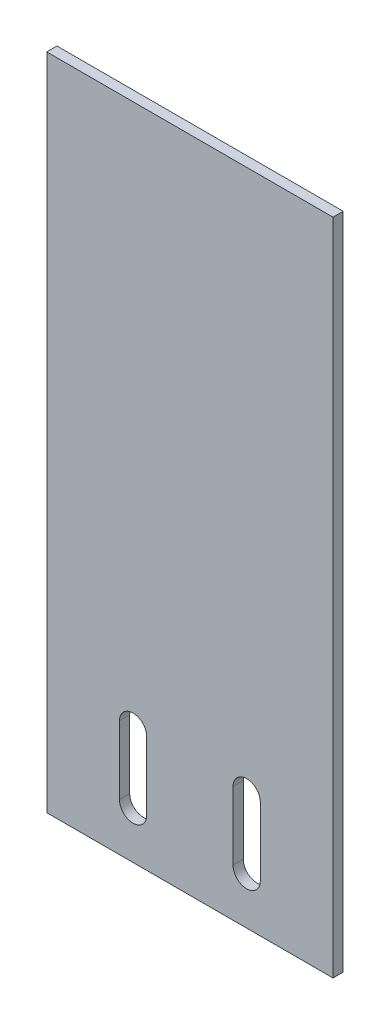
from build123d import *

# Parameters (mm, degrees)
SKETCH1_W           = 126
SKETCH1_H           = 290
BOSS_EXTRUDE2_DEPTH = 4.5


with BuildPart() as part:
    # Sketch1 → Boss-Extrude2 (new body)
    with BuildSketch(Plane.XY):
        Rectangle(SKETCH1_W, SKETCH1_H)
        with BuildLine():
            Line((-19, -109), (-19, -124))
            ThreePointArc((-19, -124), (-25, -130), (-31, -124))
            Line((-31, -124), (-31, -94))
            ThreePointArc((-31, -94), (-25, -88), (-19, -94))
            Line((-19, -94), (-19, -109))
        make_face(mode=Mode.SUBTRACT)
        with BuildLine():
            ThreePointArc((31, -124), (25, -130), (19, -124))
            Line((19, -124), (19, -94))
            ThreePointArc((19, -94), (25, -88), (31, -94))
            Line((31, -94), (31, -124))
        make_face(mode=Mode.SUBTRACT)
    extrude(amount=BOSS_EXTRUDE2_DEPTH)


solid = part.part
